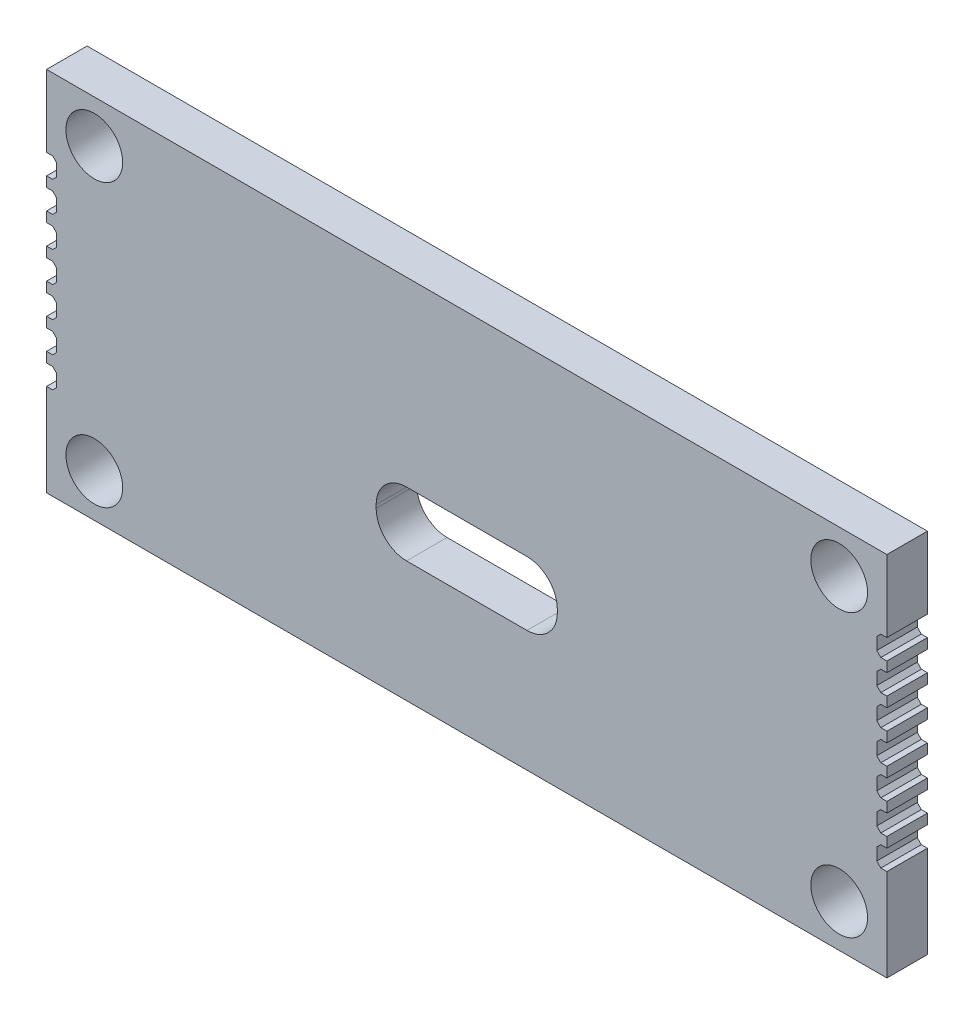
from build123d import *

# Parameters (mm, degrees)
SKETCH_1_R          = 1.4
EXTRUDE_2_DEPTH     = 2
CUT_EXTRUDE_1_REACH = 26.88


with BuildPart() as part:
    # 草图1 → 凸台-拉伸2 (new body)
    with BuildSketch(Plane.XY):
        Polygon((20.737338075, 10.050011688), (20.737338075, 13.600023376), (-20.737338075, 13.600023376), (-20.737338075, 10.050011688), (-20.437338075, 10.050011688), (-20.237338075, 9.850011688), (-20.237338075, 9.250011688), (-20.437338075, 9.050011688), (-20.737338075, 9.050011688), (-20.737338075, 8.550011688), (-20.437338075, 8.550011688), (-20.237338075, 8.350011688), (-20.237338075, 7.750011688), (-20.437338075, 7.550011688), (-20.737338075, 7.550011688), (-20.737338075, 7.050011688), (-20.437338075, 7.050011688), (-20.237338075, 6.850011688), (-20.237338075, 6.250011688), (-20.437338075, 6.050011688), (-20.737338075, 6.050011688), (-20.737338075, 5.550011688), (-20.437338075, 5.550011688), (-20.237338075, 5.350011688), (-20.237338075, 4.750011688), (-20.437338075, 4.550011688), (-20.737338075, 4.550011688), (-20.737338075, 4.050011688), (-20.437338075, 4.050011688), (-20.237338075, 3.850011688), (-20.237338075, 3.250011688), (-20.437338075, 3.050011688), (-20.737338075, 3.050011688), (-20.737338075, 2.550011688), (-20.437338075, 2.550011688), (-20.237338075, 2.350011688), (-20.237338075, 1.750011688), (-20.437338075, 1.550011688), (-20.737338075, 1.550011688), (-20.737338075, 1.050011688), (-20.437338075, 1.050011688), (-20.237338075, 0.850011688), (-20.237338075, 0.250011688), (-20.437338075, 0.050011688), (-20.737338075, 0.050011688), (-20.737338075, -4.5), (20.737338075, -4.5), (20.737338075, 0.050011688), (20.437338075, 0.050011688), (20.237338075, 0.250011688), (20.237338075, 0.850011688), (20.437338075, 1.050011688), (20.737338075, 1.050011688), (20.737338075, 1.550011688), (20.437338075, 1.550011688), (20.237338075, 1.750011688), (20.237338075, 2.350011688), (20.437338075, 2.550011688), (20.737338075, 2.550011688), (20.737338075, 3.050011688), (20.437338075, 3.050011688), (20.237338075, 3.250011688), (20.237338075, 3.850011688), (20.437338075, 4.050011688), (20.737338075, 4.050011688), (20.737338075, 4.550011688), (20.437338075, 4.550011688), (20.237338075, 4.750011688), (20.237338075, 5.350011688), (20.437338075, 5.550011688), (20.737338075, 5.550011688), (20.737338075, 6.050011688), (20.437338075, 6.050011688), (20.237338075, 6.250011688), (20.237338075, 6.850011688), (20.437338075, 7.050011688), (20.737338075, 7.050011688), (20.737338075, 7.550011688), (20.437338075, 7.550011688), (20.237338075, 7.750011688), (20.237338075, 8.350011688), (20.437338075, 8.550011688), (20.737338075, 8.550011688), (20.737338075, 9.050011688), (20.437338075, 9.050011688), (20.237338075, 9.250011688), (20.237338075, 9.850011688), (20.437338075, 10.050011688), align=None)
        with Locations((-18.383061341, 11.500023376)):
            Circle(SKETCH_1_R, mode=Mode.SUBTRACT)
        with Locations((-18.383061341, -2.4)):
            Circle(SKETCH_1_R, mode=Mode.SUBTRACT)
        with Locations((18.383061341, -2.4)):
            Circle(SKETCH_1_R, mode=Mode.SUBTRACT)
        with Locations((18.383061341, 11.500023376)):
            Circle(SKETCH_1_R, mode=Mode.SUBTRACT)
    extrude(amount=EXTRUDE_2_DEPTH)

    # 草图2 → 切除-拉伸1 (cut, up to next)
    with BuildSketch(Plane(origin=(0, 0, 0), x_dir=(-1, 0, 0), z_dir=(0, 0, -1)), mode=Mode.PRIVATE) as cut_extrude_1_sk1:
        with BuildLine():
            Line((2.97, 4.63388738), (-2.97, 4.63388738))
            ThreePointArc((-2.97, 4.63388738), (-4.030660172, 4.194547552), (-4.47, 3.13388738))
            Line((-4.47, 3.13388738), (-4.47, 2.97388738))
            ThreePointArc((-4.47, 2.97388738), (-4.030660172, 1.913227209), (-2.97, 1.47388738))
            Line((-2.97, 1.47388738), (-0.05, 1.47388738))
            Line((-0.05, 1.47388738), (2.97, 1.47388738))
            ThreePointArc((2.97, 1.47388738), (4.030660172, 1.913227209), (4.47, 2.97388738))
            Line((4.47, 2.97388738), (4.47, 3.13388738))
            ThreePointArc((4.47, 3.13388738), (4.030660172, 4.194547552), (2.97, 4.63388738))
        make_face()
    cut_extrude_1_tool1 = extrude(cut_extrude_1_sk1.sketch, amount=-CUT_EXTRUDE_1_REACH, mode=Mode.PRIVATE) & part.part
    add(cut_extrude_1_tool1.solids().sort_by_distance((0, 3.053887, 0))[0], mode=Mode.SUBTRACT)


solid = part.part
